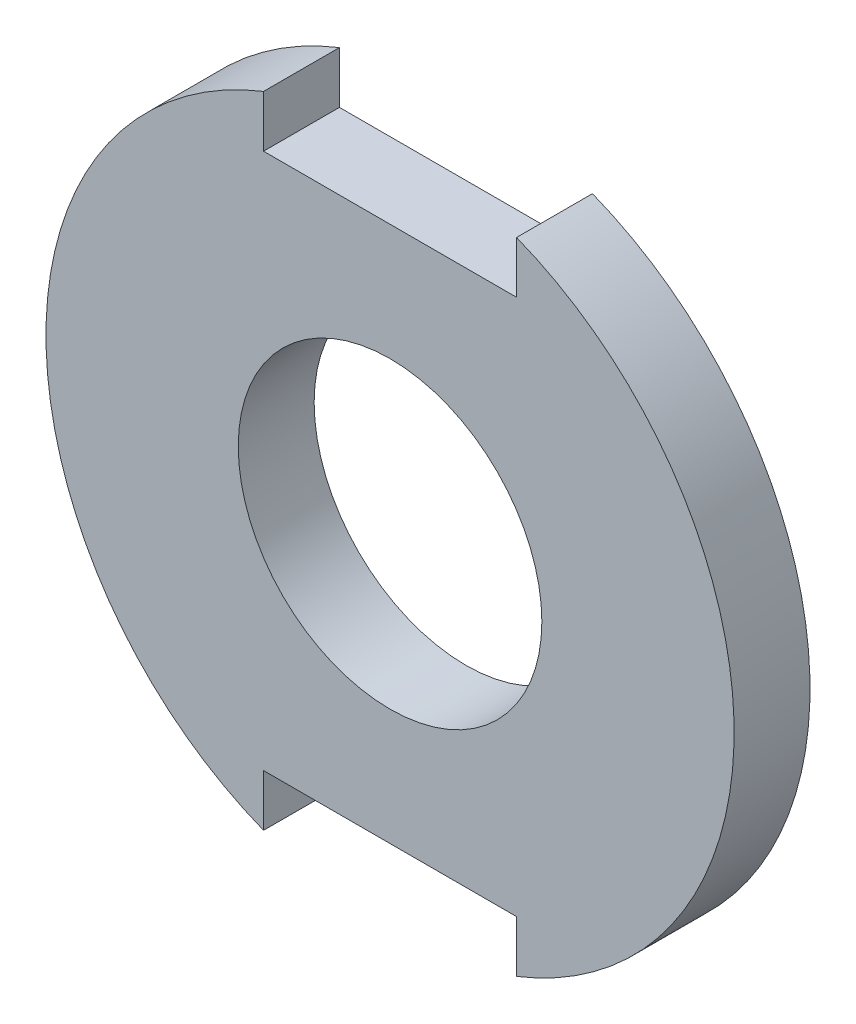
from build123d import *

# Parameters (mm, degrees)
SKETCH_1_R          = 13.6
SKETCH_1_R_2        = 6
EXTRUDE_1_DEPTH     = 3
SKETCH_2_W          = 10
SKETCH_2_H          = 6
CUT_EXTRUDE_1_DEPTH = 3


with BuildPart() as part:
    # 스케치1 → 보스-돌출1 (new body)
    with BuildSketch(Plane.XY):
        Circle(SKETCH_1_R)
        Circle(SKETCH_1_R_2, mode=Mode.SUBTRACT)
    extrude(amount=EXTRUDE_1_DEPTH)

    # 스케치2 → 컷-돌출1 (cut)
    with BuildSketch(Plane(origin=(0, 0, 0), x_dir=(-1, 0, 0), z_dir=(0, 0, -1))):
        with Locations((0, -13.6)):
            Rectangle(SKETCH_2_W, SKETCH_2_H)
        with Locations((0, 13.6)):
            Rectangle(SKETCH_2_W, SKETCH_2_H)
    extrude(amount=-CUT_EXTRUDE_1_DEPTH, mode=Mode.SUBTRACT)


solid = part.part
